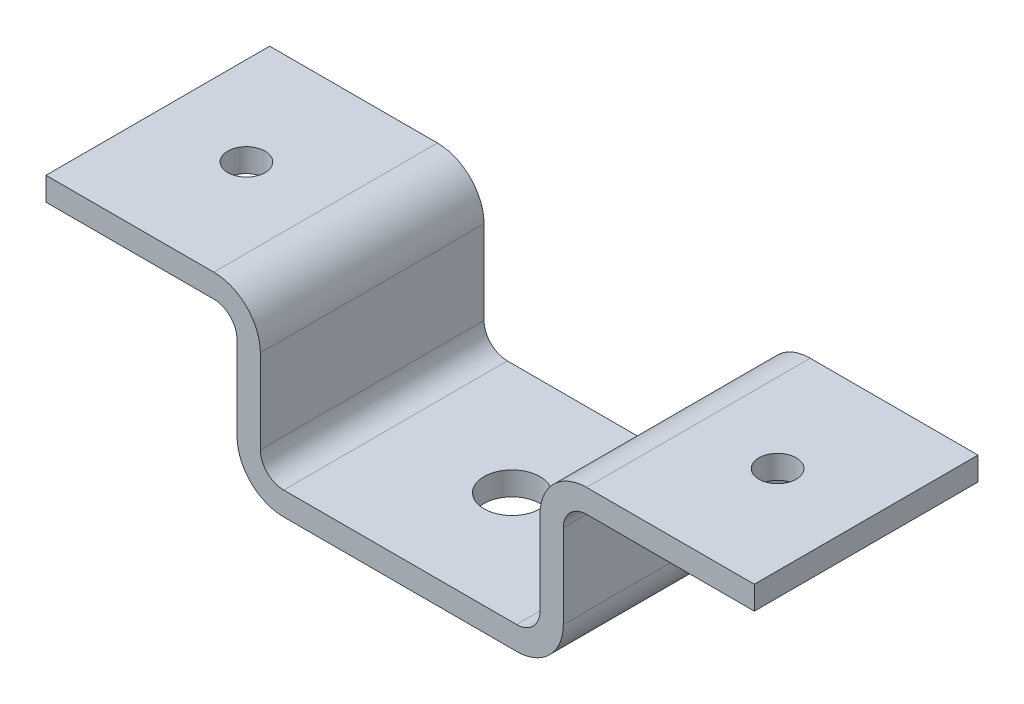
from build123d import *

# Parameters (mm, degrees)
SKETCH1_W           = 241.3
SKETCH1_H           = 76.2
BOSS_EXTRUDE1_DEPTH = 60.325
SKETCH3_W           = 65.0748
SKETCH3_H           = 52.3748
CUT_EXTRUDE4_DEPTH  = 261.136955516
SKETCH6_W           = 95.25
SKETCH6_H           = 52.3748
CUT_EXTRUDE5_DEPTH  = 261.136955516
SKETCH7_W           = 65.0748
SKETCH7_H           = 52.3748
CUT_EXTRUDE6_DEPTH  = 261.136955516
SKETCH8_R           = 6.35
CUT_EXTRUDE7_DEPTH  = 261.136955516
SKETCH9_R           = 9.525
CUT_EXTRUDE8_DEPTH  = 261.136955516
FILLET1_R           = 15.875
FILLET2_R           = 7.9502
FILLET3_R           = 7.9502
FILLET4_R           = 15.875
FILLET5_R           = 15.875
FILLET6_R           = 15.875
FILLET7_R           = 7.9502
FILLET8_R           = 7.9502


with BuildPart() as part:
    # Sketch1 → Boss-Extrude1 (new body)
    with BuildSketch(Plane(origin=(0, 0, 0), x_dir=(1, 0, 0), z_dir=(0, 1, 0))):
        with Locations((120.65, 38.1)):
            Rectangle(SKETCH1_W, SKETCH1_H)
    extrude(amount=BOSS_EXTRUDE1_DEPTH)

    # Sketch3 → Cut-Extrude4 (cut, through all)
    with BuildSketch(Plane.XY):
        with Locations((208.7626, 26.1874)):
            Rectangle(SKETCH3_W, SKETCH3_H)
    extrude(amount=-CUT_EXTRUDE4_DEPTH, mode=Mode.SUBTRACT)

    # Sketch6 → Cut-Extrude5 (cut, through all)
    with BuildSketch(Plane.XY):
        with Locations((120.65, 34.1376)):
            Rectangle(SKETCH6_W, SKETCH6_H)
    extrude(amount=-CUT_EXTRUDE5_DEPTH, mode=Mode.SUBTRACT)

    # Sketch7 → Cut-Extrude6 (cut, through all)
    with BuildSketch(Plane.XY):
        with Locations((32.5374, 26.1874)):
            Rectangle(SKETCH7_W, SKETCH7_H)
    extrude(amount=-CUT_EXTRUDE6_DEPTH, mode=Mode.SUBTRACT)

    # Sketch8 → Cut-Extrude7 (cut, through all)
    with BuildSketch(Plane(origin=(0, 60.325, 0), x_dir=(1, 0, 0), z_dir=(0, 1, 0))):
        with Locations(Location((30.1752, 38.1, 0), (0, 0, 270))):
            Circle(SKETCH8_R)
        with Locations(Location((211.1248, 38.1, 0), (0, 0, 270))):
            Circle(SKETCH8_R)
    extrude(amount=-CUT_EXTRUDE7_DEPTH, mode=Mode.SUBTRACT)

    # Sketch9 → Cut-Extrude8 (cut, through all)
    with BuildSketch(Plane(origin=(0, 60.325, 0), x_dir=(1, 0, 0), z_dir=(0, 1, 0))):
        with Locations(Location((120.65, 38.1, 0), (0, 0, 270))):
            Circle(SKETCH9_R)
    extrude(amount=-CUT_EXTRUDE8_DEPTH, mode=Mode.SUBTRACT)

    # Fillet1
    fillet1_edges = [part.edges().sort_by_distance(p)[0] for p in [
        (73.025, 60.325, -38.1),
    ]]
    fillet(fillet1_edges, radius=FILLET1_R)

    # Fillet2
    fillet2_edges = [part.edges().sort_by_distance(p)[0] for p in [
        (73.025, 7.9502, -38.1),
    ]]
    fillet(fillet2_edges, radius=FILLET2_R)

    # Fillet3
    fillet3_edges = [part.edges().sort_by_distance(p)[0] for p in [
        (168.275, 7.9502, -38.1),
    ]]
    fillet(fillet3_edges, radius=FILLET3_R)

    # Fillet4
    fillet4_edges = [part.edges().sort_by_distance(p)[0] for p in [
        (168.275, 60.325, -38.1),
    ]]
    fillet(fillet4_edges, radius=FILLET4_R)

    # Fillet5
    fillet5_edges = [part.edges().sort_by_distance(p)[0] for p in [
        (176.2252, 0, -38.1),
    ]]
    fillet(fillet5_edges, radius=FILLET5_R)

    # Fillet6
    fillet6_edges = [part.edges().sort_by_distance(p)[0] for p in [
        (65.0748, 0, -38.1),
    ]]
    fillet(fillet6_edges, radius=FILLET6_R)

    # Fillet7
    fillet7_edges = [part.edges().sort_by_distance(p)[0] for p in [
        (65.0748, 52.3748, -38.1),
    ]]
    fillet(fillet7_edges, radius=FILLET7_R)

    # Fillet8
    fillet8_edges = [part.edges().sort_by_distance(p)[0] for p in [
        (176.2252, 52.3748, -38.1),
    ]]
    fillet(fillet8_edges, radius=FILLET8_R)


solid = part.part
